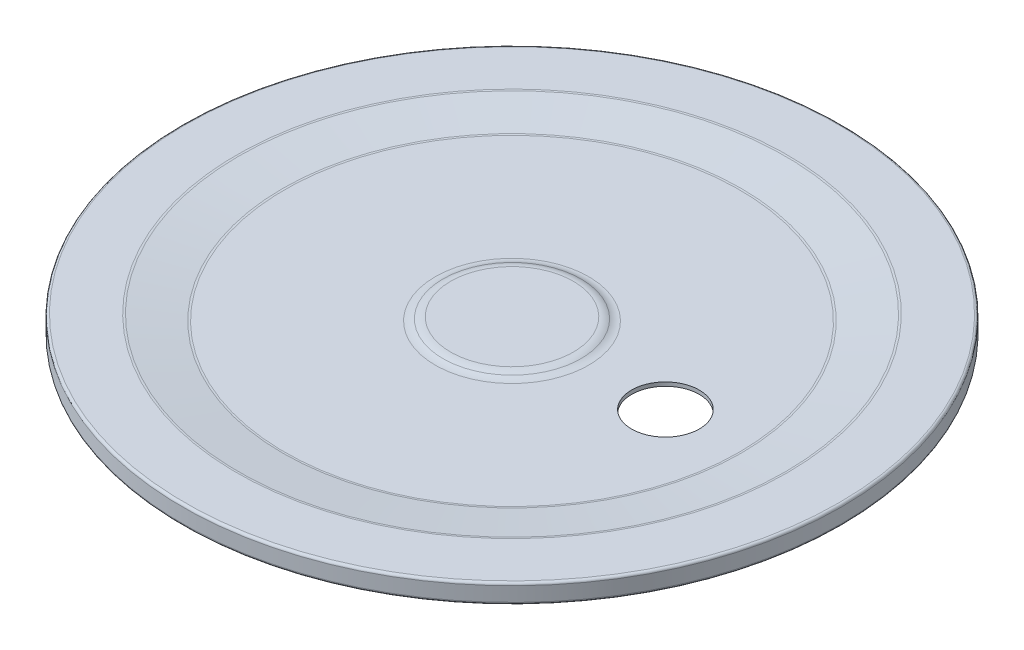
from build123d import *
from OCP.BRepFilletAPI import BRepFilletAPI_MakeFillet

# Parameters (mm, degrees)
FILLET16_R1        = 1.524
FILLET16_R2        = 0.254
SKETCH16839_R      = 3.499999985
CUT_EXTRUDE2_DEPTH = 2.54


with BuildPart() as part:
    # Sketch7041 → Revolve5 (revolve)
    with BuildSketch(Plane.XY):
        with BuildLine():
            Line((0, 81.50225), (6.35, 81.50225))
            ThreePointArc((6.35, 81.50225), (6.758144984, 81.453958267), (7.14375, 81.31175))
            ThreePointArc((7.14375, 81.31175), (7.529355016, 81.169541733), (7.9375, 81.12125))
            Line((7.9375, 81.12125), (23.6225, 81.12125))
            Line((23.6225, 81.12125), (28.385, 81.75625))
            Line((28.385, 81.75625), (34.1, 81.75625))
            Line((34.1, 81.75625), (34.1, 79.75625))
            Line((34.1, 79.75625), (33.703125, 79.75625))
            Line((33.703125, 79.75625), (33.703125, 81.359375))
            Line((33.703125, 81.359375), (28.411341775, 81.359375))
            Line((28.411341775, 81.359375), (23.648841775, 80.724375))
            Line((23.648841775, 80.724375), (7.9375, 80.724375))
            ThreePointArc((7.9375, 80.724375), (7.436735125, 80.783625522), (6.963625189, 80.958104955))
            ThreePointArc((6.963625189, 80.958104955), (6.665525094, 81.068042057), (6.35, 81.105375))
            Line((6.35, 81.105375), (0, 81.105375))
            Line((0, 81.105375), (0, 81.50225))
        make_face()
    revolve(axis=Axis((0, 82.55, 0), (0, -1, 0)))

    # Fillet16: one fillet with a radius per group of edges: ONE call of the kernel's fillet builder (fillet() takes one radius for all edges)
    fillet16_edges_1 = [part.edges().sort_by_distance(p)[0] for p in [
        (-23.6225, 81.12125, 0),
        (-28.385, 81.75625, 0),
        (-23.648841775, 80.724375, 0),
        (-28.411341775, 81.359375, 0),
    ]]
    fillet16_edges_2 = [part.edges().sort_by_distance(p)[0] for p in [
        (-34.1, 81.75625, 0),
        (-33.703125, 81.359375, 0),
        (-34.1, 79.75625, 0),
    ]]
    fillet16 = BRepFilletAPI_MakeFillet(part.part.solid().wrapped)
    for e in fillet16_edges_1:
        fillet16.Add(FILLET16_R1, e.wrapped)
    for e in fillet16_edges_2:
        fillet16.Add(FILLET16_R2, e.wrapped)
    add(Compound.cast(fillet16.Shape()), mode=Mode.REPLACE)

    # Sketch16839 → Cut-Extrude2 (cut)
    with BuildSketch(Plane(origin=(0, 81.12125, 0), x_dir=(1, 0, 0), z_dir=(0, 1, 0))):
        with Locations((15.875, 0)):
            Circle(SKETCH16839_R)
    extrude(amount=-CUT_EXTRUDE2_DEPTH, mode=Mode.SUBTRACT)


with BuildPart() as body_2:
    # Sketch7042 → Revolve6 (revolve)
    with BuildSketch(Plane.XY):
        with BuildLine():
            Line((27.935091775, 81.295875), (33.449125, 81.295875))
            ThreePointArc((33.449125, 81.295875), (33.527819825, 81.268555111), (33.572657423, 81.198349403))
            ThreePointArc((33.572657423, 81.198349403), (33.670396019, 80.647686296), (33.703125, 80.089375))
            Line((33.703125, 80.089375), (33.703125, 81.359375))
            Line((33.703125, 81.359375), (28.411341775, 81.359375))
            Line((28.411341775, 81.359375), (27.935091775, 81.295875))
        make_face()
    revolve(axis=Axis((0, 82.55, 0), (0, -1, 0)))


solid = Compound([part.part, body_2.part])
